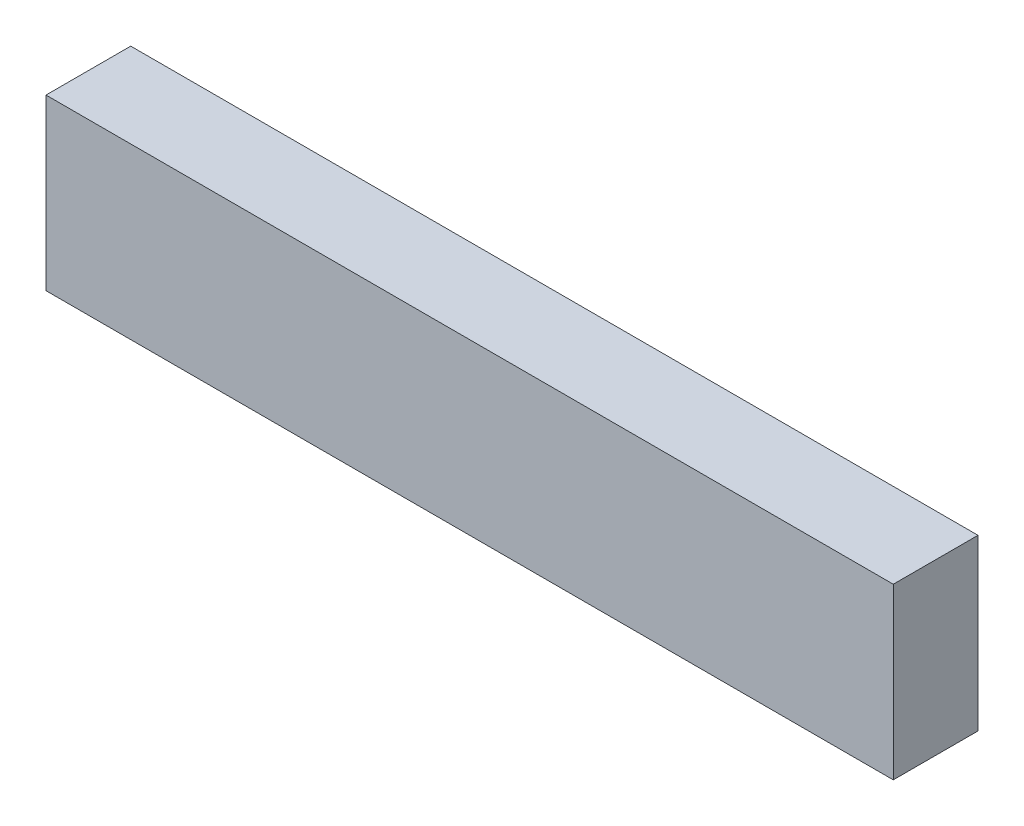
from build123d import *

# Parameters (mm, degrees)
SKETCH1_W      = 1000
SKETCH1_H      = 2000
EXTRUDE1_DEPTH = 10000


with BuildPart() as part:
    # Sketch1 → Extrude1 (new body)
    with BuildSketch(Plane(origin=(0, 0, 0), x_dir=(0, 0, -1), z_dir=(1, 0, 0))):
        with Locations((-500, -967.16120687)):
            Rectangle(SKETCH1_W, SKETCH1_H)
    extrude(amount=EXTRUDE1_DEPTH)


solid = part.part
